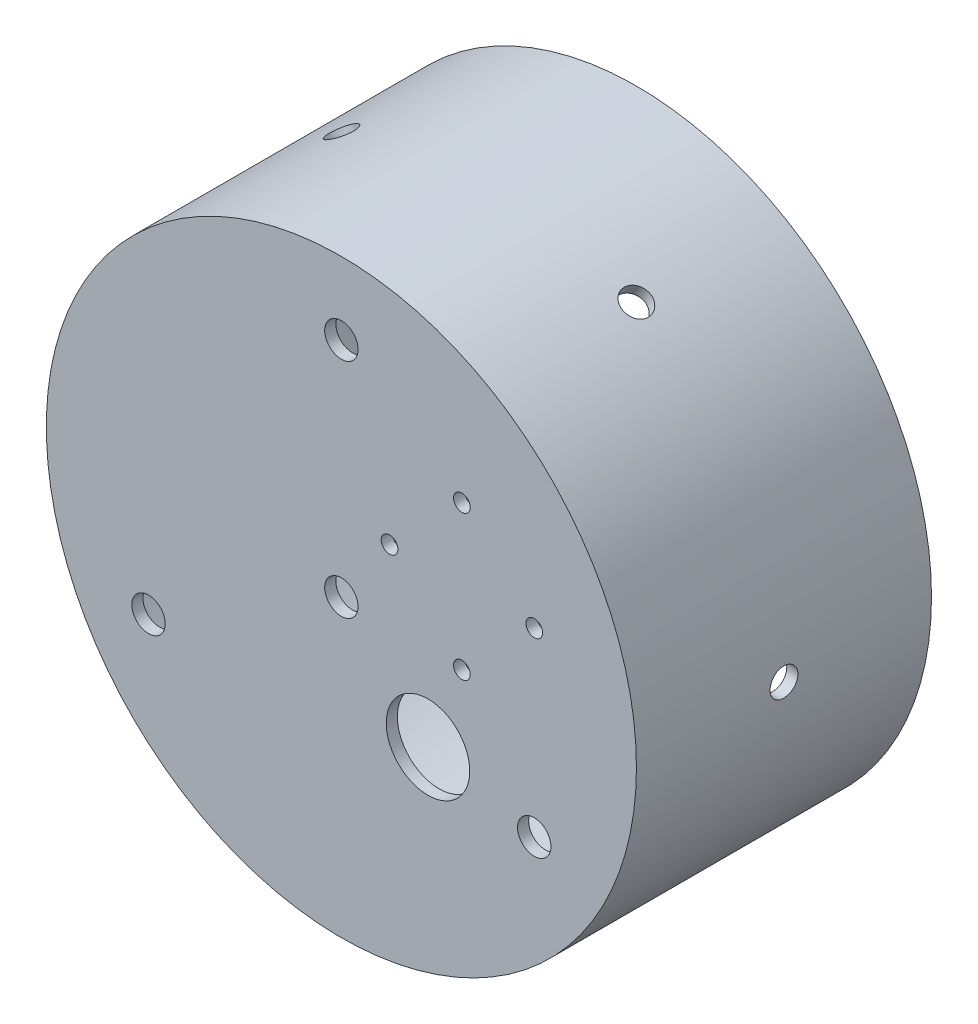
from build123d import *

# Parameters (mm, degrees)
SKETCH1_R           = 53
BOSS_EXTRUDE1_DEPTH = 53
SKETCH2_R           = 3
CUT_EXTRUDE1_DEPTH  = 92.798692801
SHELL4_T            = -2
SKETCH6_R           = 1.5
CUT_EXTRUDE3_DEPTH  = 10
SKETCH7_R           = 7.5
CUT_EXTRUDE4_DEPTH  = 10
SKETCH8_R           = 51
CUT_EXTRUDE5_DEPTH  = 51
SKETCH9_R           = 2.5
CUT_EXTRUDE6_DEPTH  = 51
CIRPATTERN1_COUNT   = 6


with BuildPart() as part:
    # Sketch1 → Boss-Extrude1 (new body)
    with BuildSketch(Plane.XY):
        Circle(SKETCH1_R)
    extrude(amount=BOSS_EXTRUDE1_DEPTH)

    # Sketch2 → Cut-Extrude1 (cut, through all)
    with BuildSketch(Plane.XY.offset(53)):
        with Locations((0, 40)):
            Circle(SKETCH2_R)
        with Locations((34.641016151, -20)):
            Circle(SKETCH2_R)
        with Locations((-34.641016151, -20)):
            Circle(SKETCH2_R)
        Circle(SKETCH2_R)
    extrude(amount=-CUT_EXTRUDE1_DEPTH, mode=Mode.SUBTRACT)

    # Shell4
    shell4_openings = [part.faces().sort_by_distance(p)[0] for p in [
        (-51.500933624, 0, 0),
    ]]
    offset(amount=SHELL4_T, openings=shell4_openings, kind=Kind.INTERSECTION)

    # Sketch6 → Cut-Extrude3 (cut)
    with BuildSketch(Plane.XY.offset(53)):
        with Locations((21.650635095, 25.5)):
            Circle(SKETCH6_R)
        with Locations((34.650635095, 12.5)):
            Circle(SKETCH6_R)
        with Locations((21.650635095, -0.5)):
            Circle(SKETCH6_R)
        with Locations((8.650635095, 12.5)):
            Circle(SKETCH6_R)
    extrude(amount=-CUT_EXTRUDE3_DEPTH, mode=Mode.SUBTRACT)

    # Sketch7 → Cut-Extrude4 (cut)
    with BuildSketch(Plane.XY.offset(53)):
        with Locations((15.556349186, -15.556349186)):
            Circle(SKETCH7_R)
    extrude(amount=-CUT_EXTRUDE4_DEPTH, mode=Mode.SUBTRACT)

    # Sketch8 → Cut-Extrude5 (cut)
    with BuildSketch(Plane(origin=(0, 0, 0), x_dir=(-1, 0, 0), z_dir=(0, 0, -1))):
        with Locations(Location((0, 0, 0), (0, 0, 180))):
            Circle(SKETCH8_R)
    extrude(amount=-CUT_EXTRUDE5_DEPTH, mode=Mode.SUBTRACT)

    # Sketch9 → Cut-Extrude6 (cut)
    with BuildSketch(Plane.ZY.offset(53)):
        with Locations((26.5, 0)):
            Circle(SKETCH9_R)
    cut_extrude6 = extrude(amount=-CUT_EXTRUDE6_DEPTH, mode=Mode.SUBTRACT)

    # CirPattern1: Cut-Extrude6 ×6 about axis
    cirpattern1_axis = Axis((0, 0, 0), (0, 0, 1))
    for i in range(1, CIRPATTERN1_COUNT):
        add(cut_extrude6.rotate(cirpattern1_axis, i * 360 / CIRPATTERN1_COUNT), mode=Mode.SUBTRACT)


solid = part.part
